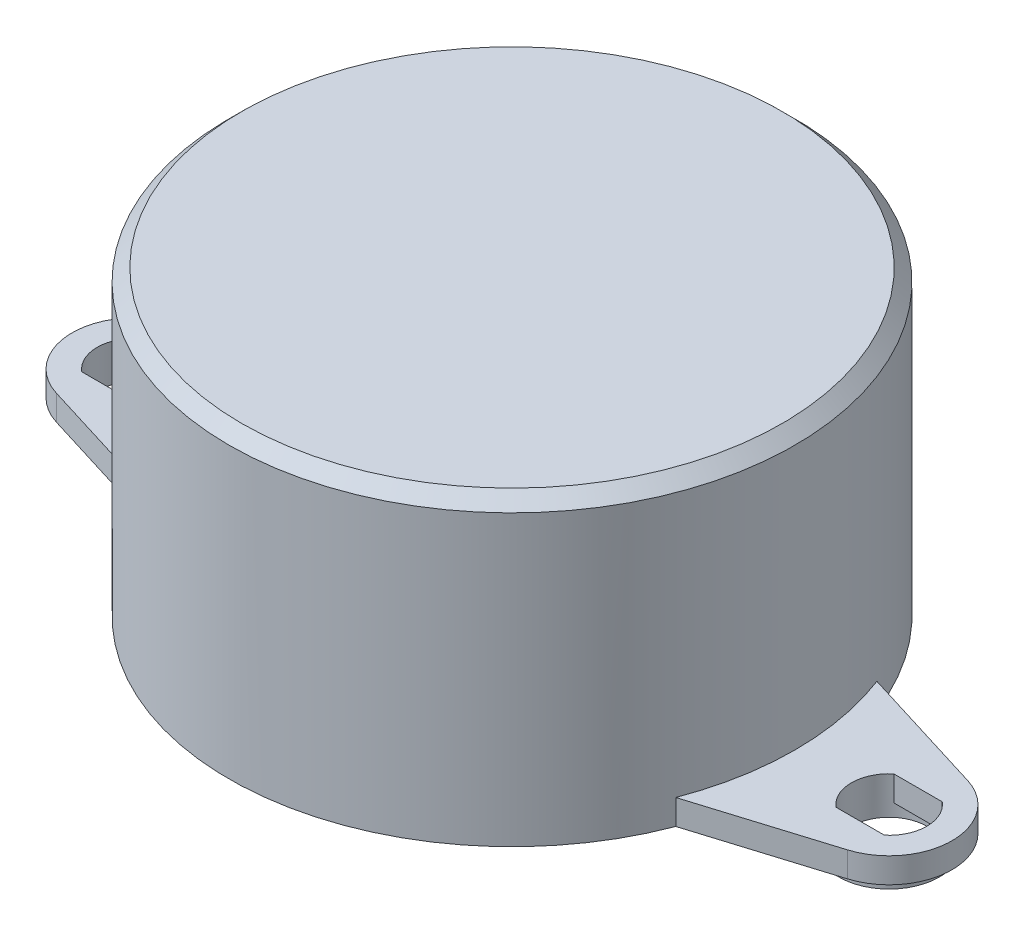
from build123d import *

# Parameters (mm, degrees)
SKETCH1_R           = 11.25
BOSS_EXTRUDE1_DEPTH = 12
CHAMFER1_SIZE       = 0.5
BOSS_EXTRUDE2_DEPTH = 1
BOSS_EXTRUDE3_START = 0.5
SKETCH3_R           = 2
SKETCH3_R_2         = 1.5
BOSS_EXTRUDE3_DEPTH = 0.5


with BuildPart() as part:
    # Sketch1 → Boss-Extrude1 (new body)
    with BuildSketch(Plane(origin=(0, 0, 0), x_dir=(1, 0, 0), z_dir=(0, 1, 0))):
        with Locations(Location((0, 0, 0), (0, 0, 270))):
            Circle(SKETCH1_R)
    extrude(amount=BOSS_EXTRUDE1_DEPTH)

    # Chamfer1
    chamfer1_edges = [part.edges().sort_by_distance(p)[0] for p in [
        (0, 12, -11.25),
    ]]
    chamfer(chamfer1_edges, length=CHAMFER1_SIZE)

    # Sketch2 → Boss-Extrude2 (add)
    # profile 1 of 2: a face of its own
    with BuildSketch(Plane.XZ):
        with BuildLine():
            Line((-15.737008616, 2.388894786), (-10.514870422, 4))
            ThreePointArc((-10.514870422, 4), (-11.25, 0), (-10.514870422, -4))
            Line((-10.514870422, -4), (-15.737008616, -2.388894786))
            ThreePointArc((-15.737008616, -2.388894786), (-17.5, 0), (-15.737008616, 2.388894786))
        make_face()
        with BuildLine():
            Line((-15.963068014, 1.15), (-14.036931986, 1.15))
            ThreePointArc((-14.036931986, 1.15), (-13.5, 0), (-14.036931986, -1.15))
            Line((-14.036931986, -1.15), (-15.963068014, -1.15))
            ThreePointArc((-15.963068014, -1.15), (-16.5, 0), (-15.963068014, 1.15))
        make_face(mode=Mode.SUBTRACT)
    # profile 2 of 2: a face of its own
    with BuildSketch(Plane.XZ):
        with BuildLine():
            Line((15.737008616, -2.388894786), (10.514870422, -4))
            ThreePointArc((10.514870422, -4), (11.25, 0), (10.514870422, 4))
            Line((10.514870422, 4), (15.737008616, 2.388894786))
            ThreePointArc((15.737008616, 2.388894786), (17.5, 0), (15.737008616, -2.388894786))
        make_face()
        with BuildLine():
            Line((14.036931986, 1.15), (15.963068014, 1.15))
            ThreePointArc((15.963068014, 1.15), (16.5, 0), (15.963068014, -1.15))
            Line((15.963068014, -1.15), (14.036931986, -1.15))
            ThreePointArc((14.036931986, -1.15), (13.5, 0), (14.036931986, 1.15))
        make_face(mode=Mode.SUBTRACT)
    extrude(amount=-BOSS_EXTRUDE2_DEPTH)

    # Sketch3 → Boss-Extrude3 (add)
    # profile 1 of 2: a face of its own
    with BuildSketch(Plane.XZ.offset(BOSS_EXTRUDE3_START)):
        with Locations(Location((15, 0, 0), (0, 0, 270))):
            Circle(SKETCH3_R)
        with Locations(Location((15, 0, 0), (0, 0, 270))):
            Circle(SKETCH3_R_2, mode=Mode.SUBTRACT)
    # profile 2 of 2: a face of its own
    with BuildSketch(Plane.XZ.offset(BOSS_EXTRUDE3_START)):
        with Locations(Location((-15, 0, 0), (0, 0, 90))):
            Circle(SKETCH3_R)
        with Locations(Location((-15, 0, 0), (0, 0, 270))):
            Circle(SKETCH3_R_2, mode=Mode.SUBTRACT)
    extrude(amount=-BOSS_EXTRUDE3_DEPTH)


solid = part.part
